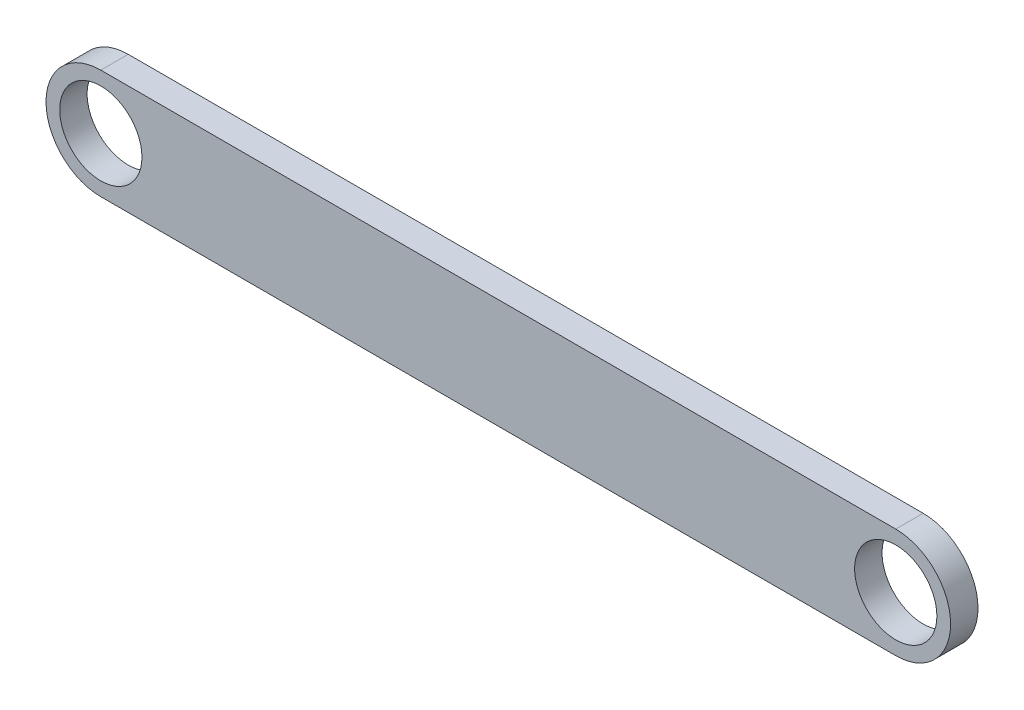
from build123d import *

# Parameters (mm, degrees)
SKETCH_1_R      = 15
EXTRUDE_1_DEPTH = 10


with BuildPart() as part:
    # Эскиз1 → Бобышка-Вытянуть1 (new body)
    with BuildSketch(Plane.XY):
        with BuildLine():
            Line((0, 20), (290, 20))
            ThreePointArc((290, 20), (310, 0), (290, -20))
            Line((290, -20), (0, -20))
            ThreePointArc((0, -20), (-20, 0), (0, 20))
        make_face()
        Circle(SKETCH_1_R, mode=Mode.SUBTRACT)
        with Locations((290, 0)):
            Circle(SKETCH_1_R, mode=Mode.SUBTRACT)
    extrude(amount=EXTRUDE_1_DEPTH)


solid = part.part
